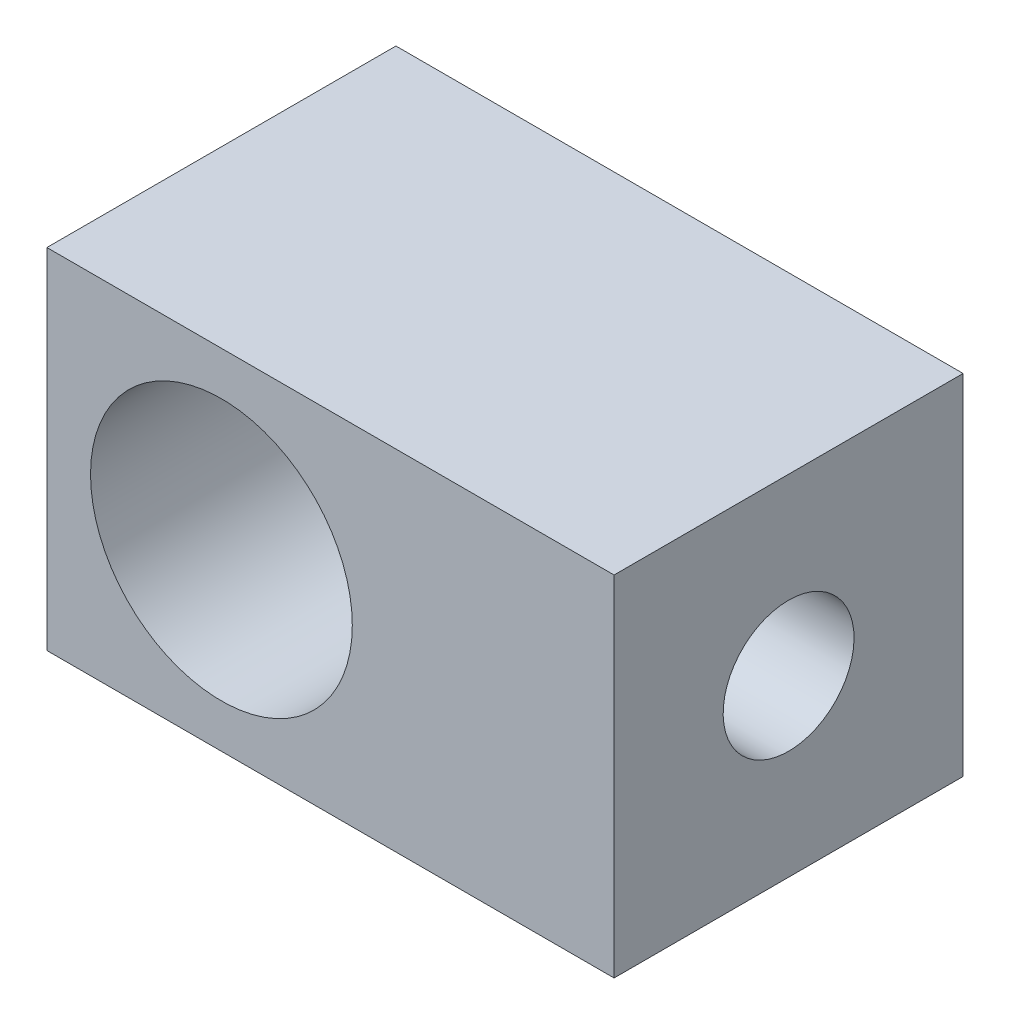
from build123d import *

# Parameters (mm, degrees)
SKETCH2_W           = 8
SKETCH2_H           = 8
BOSS_EXTRUDE1_DEPTH = 8
SKETCH3_R           = 3
CUT_EXTRUDE1_DEPTH  = 5
SKETCH5_W           = 8
SKETCH5_H           = 8
BOSS_EXTRUDE2_DEPTH = 5
SKETCH6_R           = 1.5
CUT_EXTRUDE2_DEPTH  = 4
CUT_EXTRUDE3_DEPTH  = 2.5
BOSS_EXTRUDE4_DEPTH = 2
CUT_EXTRUDE4_DEPTH  = 1
BOSS_EXTRUDE5_DEPTH = 2
SKETCH11_W          = 3
SKETCH11_H          = 3
CUT_EXTRUDE8_DEPTH  = 2.5


with BuildPart() as part:
    # Sketch2 → Boss-Extrude1 (new body)
    with BuildSketch(Plane.XY):
        Rectangle(SKETCH2_W, SKETCH2_H)
    extrude(amount=BOSS_EXTRUDE1_DEPTH)

    # Sketch3 → Cut-Extrude1 (cut)
    with BuildSketch(Plane.XY.offset(8)):
        Circle(SKETCH3_R)
    extrude(amount=-CUT_EXTRUDE1_DEPTH, mode=Mode.SUBTRACT)

    # Sketch5 → Boss-Extrude2 (add)
    with BuildSketch(Plane(origin=(4, 0, 0), x_dir=(0, 0, -1), z_dir=(1, 0, 0))):
        with Locations((-4, 0)):
            Rectangle(SKETCH5_W, SKETCH5_H)
    extrude(amount=BOSS_EXTRUDE2_DEPTH)

    # Sketch6 → Cut-Extrude2 (cut)
    with BuildSketch(Plane(origin=(9, 0, 0), x_dir=(0, 0, -1), z_dir=(1, 0, 0))):
        with Locations(Location((-4, 0, 0), (0, 0, 90))):
            Circle(SKETCH6_R)
    extrude(amount=-CUT_EXTRUDE2_DEPTH, mode=Mode.SUBTRACT)

    # Sketch7 → Cut-Extrude3 (cut)
    with BuildSketch(Plane(origin=(0, 0, 0), x_dir=(-1, 0, 0), z_dir=(0, 0, -1))):
        Polygon((-2.5, 2.121320344), (-0.378679656, 0), (-2.5, -2.121320344), (-4.621320344, 0), align=None)
    extrude(amount=-CUT_EXTRUDE3_DEPTH, mode=Mode.SUBTRACT)

    # Sketch8 → Boss-Extrude4 (add)
    with BuildSketch(Plane(origin=(0, 0, 0), x_dir=(-1, 0, 0), z_dir=(0, 0, -1))):
        Polygon((-4.621320344, 0), (-2.5, 2.121320344), (-0.378679656, 0), (-2.5, -2.121320344), align=None)
    extrude(amount=-BOSS_EXTRUDE4_DEPTH)

    # Sketch9 → Cut-Extrude4 (cut)
    with BuildSketch(Plane(origin=(0, 0, 0), x_dir=(-1, 0, 0), z_dir=(0, 0, -1))):
        Polygon((-6.487359326, 0), (-5.148694176, 2.68476733), (-2.463926846, 1.346102179), (-3.802591997, -1.338665151), align=None)
    extrude(amount=-CUT_EXTRUDE4_DEPTH, mode=Mode.SUBTRACT)

    # Sketch10 → Boss-Extrude5 (add)
    with BuildSketch(Plane(origin=(0, 0, 0), x_dir=(-1, 0, 0), z_dir=(0, 0, -1))):
        Polygon((-5.148694176, 2.68476733), (-2.463926846, 1.346102179), (-3.802591997, -1.338665151), (-6.487359326, 0), align=None)
    extrude(amount=-BOSS_EXTRUDE5_DEPTH)

    # Sketch11 → Cut-Extrude8 (cut)
    with BuildSketch(Plane(origin=(0, 0, 0), x_dir=(-1, 0, 0), z_dir=(0, 0, -1))):
        with Locations((-2.5, 0)):
            Rectangle(SKETCH11_W, SKETCH11_H)
    extrude(amount=-CUT_EXTRUDE8_DEPTH, mode=Mode.SUBTRACT)


solid = part.part
